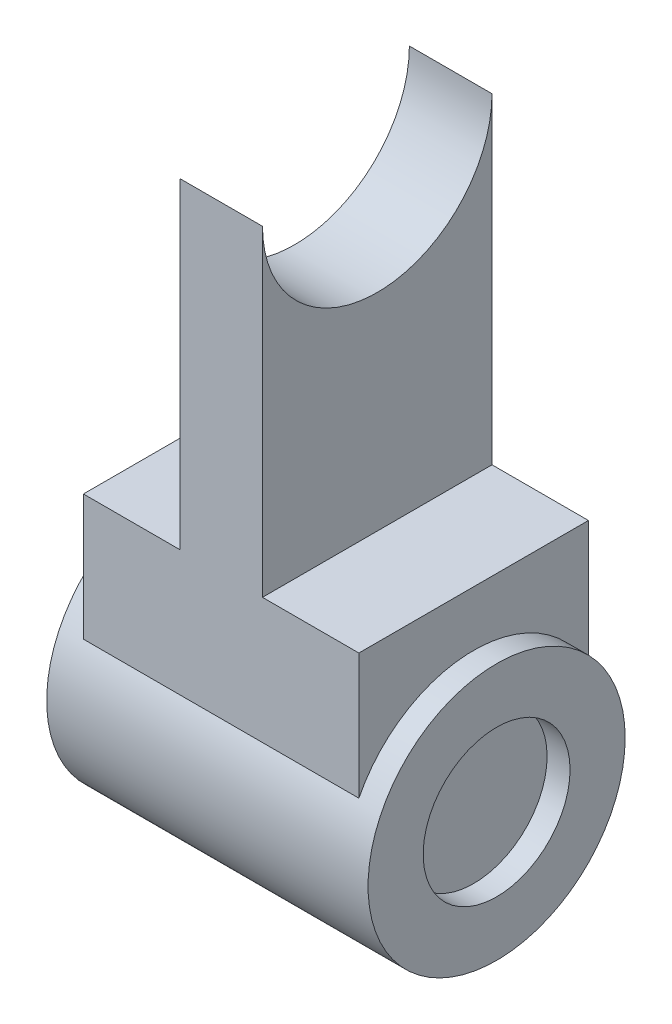
from build123d import *

# Parameters (mm, degrees)
SKETCH1_R           = 28
SKETCH1_R_2         = 16
BOSS_EXTRUDE1_DEPTH = 35
BOSS_EXTRUDE2_DEPTH = 30
BOSS_EXTRUDE3_DEPTH = 9


with BuildPart() as part:
    # Sketch1 → Boss-Extrude1 (new, symmetric)
    with BuildSketch(Plane(origin=(0, 0, 0), x_dir=(0, 0, -1), z_dir=(1, 0, 0))):
        Circle(SKETCH1_R)
        Circle(SKETCH1_R_2, mode=Mode.SUBTRACT)
    extrude(amount=BOSS_EXTRUDE1_DEPTH, both=True)

    # Sketch2 → Boss-Extrude2 (add, symmetric)
    with BuildSketch(Plane(origin=(0, 0, 0), x_dir=(0, 0, -1), z_dir=(1, 0, 0))):
        with BuildLine():
            Line((-25, 40), (25, 40))
            Line((25, 40), (25, 12.609520213))
            ThreePointArc((25, 12.609520213), (0, -28), (-25, 12.609520213))
            Line((-25, 12.609520213), (-25, 40))
        make_face()
    extrude(amount=BOSS_EXTRUDE2_DEPTH, both=True)

    # Sketch3 → Boss-Extrude3 (add, symmetric)
    with BuildSketch(Plane(origin=(0, 0, 0), x_dir=(0, 0, -1), z_dir=(1, 0, 0))):
        with BuildLine():
            Line((-25, 40), (-25, 110))
            ThreePointArc((-25, 110), (0, 85), (25, 110))
            Line((25, 110), (25, 40))
            Line((25, 40), (25, 12.609520213))
            ThreePointArc((25, 12.609520213), (0, 28), (-25, 12.609520213))
            Line((-25, 12.609520213), (-25, 40))
        make_face()
    extrude(amount=BOSS_EXTRUDE3_DEPTH, both=True)


solid = part.part
